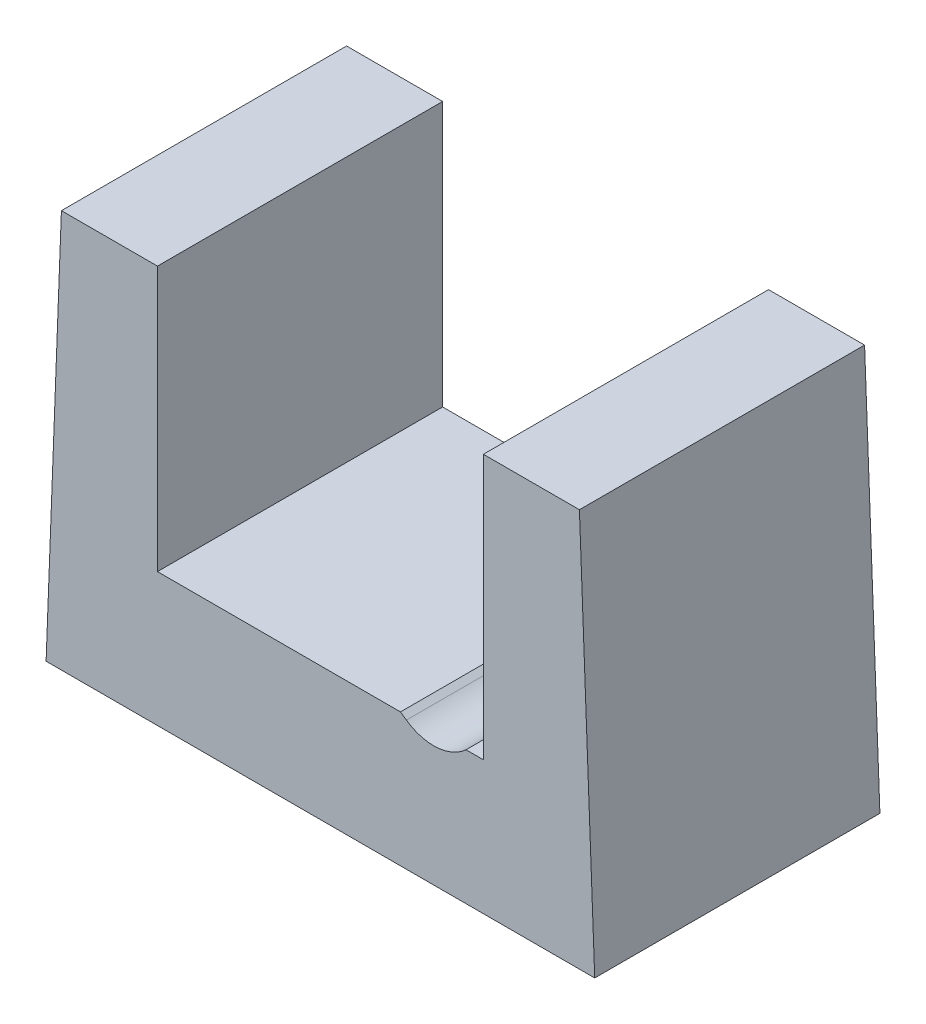
from build123d import *

# Parameters (mm, degrees)
SKETCH1_R               = 1.5
SKETCH1_R_2             = 3.95
MAIN_BODY_LINK_B1_DEPTH = 21
CUT_EXTRUDE1_REACH      = 170.233
PULLEYIDLER_DEPTH       = 21
FILLET1_R               = 1
SKETCH4_W               = 40.4
SKETCH4_H               = 7.4
SKETCH4_W_2             = 38.1446978
SKETCH4_H_2             = 45.516821784
CUT_EXTRUDE2_DEPTH      = 169.23348591
CUT_EXTRUDE4_DEPTH      = 124.656147707


with BuildPart() as part:
    # Sketch1 → Main Body Link B1 (new body)
    with BuildSketch(Plane.XY):
        with BuildLine():
            Line((0, 83.474052381), (9.1, 83.474052381))
            Line((9.1, 83.474052381), (9.1, 89.474052381))
            Line((9.1, 89.474052381), (11.1, 89.474052381))
            Line((11.1, 89.474052381), (11.1, 83.474052381))
            Line((11.1, 83.474052381), (20.2, 83.474052381))
            Line((20.2, 83.474052381), (20.2, 90.874052381))
            Line((20.2, 90.874052381), (17.986683974, 148.383116621))
            ThreePointArc((17.986683974, 148.383116621), (0, 165.690874165), (-17.986683974, 148.383116621))
            Line((-17.986683974, 148.383116621), (-20.2, 90.874052381))
            Line((-20.2, 90.874052381), (-20.2, 83.474052381))
            Line((-20.2, 83.474052381), (-11.1, 83.474052381))
            Line((-11.1, 83.474052381), (-11.1, 89.474052381))
            Line((-11.1, 89.474052381), (-9.1, 89.474052381))
            Line((-9.1, 89.474052381), (-9.1, 83.474052381))
            Line((-9.1, 83.474052381), (0, 83.474052381))
        make_face()
        with Locations(Location((5.2, 88.124052381, 0), (0, 0, 180))):
            Circle(SKETCH1_R, mode=Mode.SUBTRACT)
        with Locations(Location((15, 88.124052381, 0), (0, 0, 180))):
            Circle(SKETCH1_R, mode=Mode.SUBTRACT)
        with Locations(Location((-15, 88.124052381, 0), (0, 0, 180))):
            Circle(SKETCH1_R, mode=Mode.SUBTRACT)
        with Locations(Location((-5.2, 88.124052381, 0), (0, 0, 180))):
            Circle(SKETCH1_R, mode=Mode.SUBTRACT)
        with Locations(Location((0, 147.690874165, 0), (0, 0, 180))):
            Circle(SKETCH1_R_2, mode=Mode.SUBTRACT)
    extrude(amount=MAIN_BODY_LINK_B1_DEPTH)

    # Sketch2 → Cut-Extrude1 (cut, up to next)
    with BuildSketch(Plane.XY.offset(21), mode=Mode.PRIVATE) as cut_extrude1_sk1:
        Polygon((-3.278172542, 117.482670232), (12, 128.172168466), (12, 106.793171999), align=None)
    cut_extrude1_tool1 = extrude(cut_extrude1_sk1.sketch, amount=-CUT_EXTRUDE1_REACH, mode=Mode.PRIVATE) & part.part
    # Sketch2 → Cut-Extrude1 (cut, up to next)
    with BuildSketch(Plane.XY.offset(21), mode=Mode.PRIVATE) as cut_extrude1_sk2:
        with BuildLine():
            ThreePointArc((-12, 134.2744663), (-7.774454217, 131.456408925), (-2.929911079, 129.930929878))
            Line((-2.929911079, 129.930929878), (-12, 123.584968066))
            Line((-12, 123.584968066), (-12, 134.2744663))
        make_face()
    cut_extrude1_tool2 = extrude(cut_extrude1_sk2.sketch, amount=-CUT_EXTRUDE1_REACH, mode=Mode.PRIVATE) & part.part
    # Sketch2 → Cut-Extrude1 (cut, up to next)
    with BuildSketch(Plane.XY.offset(21), mode=Mode.PRIVATE) as cut_extrude1_sk3:
        Polygon((-12, 111.380372399), (-12, 100.690874165), (3.278172542, 100.690874165), align=None)
    cut_extrude1_tool3 = extrude(cut_extrude1_sk3.sketch, amount=-CUT_EXTRUDE1_REACH, mode=Mode.PRIVATE) & part.part
    add(cut_extrude1_tool1.solids().sort_by_distance((6.907276, 117.48267, 21))[0], mode=Mode.SUBTRACT)
    add(cut_extrude1_tool2.solids().sort_by_distance((-9.12997, 128.978342, 21))[0], mode=Mode.SUBTRACT)
    add(cut_extrude1_tool3.solids().sort_by_distance((-6.907276, 104.25404, 21))[0], mode=Mode.SUBTRACT)

    # Sketch3 → PulleyIdler (cut)
    with BuildSketch(Plane.XY.offset(21)):
        with BuildLine():
            Line((-5.959092644, 108.984491566), (6.331359583, 100.385376259))
            ThreePointArc((6.331359583, 100.385376259), (11.205592008, 101.246688207), (10.34428006, 106.120920631))
            Line((10.34428006, 106.120920631), (-1.946172167, 114.720035938))
            ThreePointArc((-1.946172167, 114.720035938), (-6.820404592, 113.85872399), (-5.959092644, 108.984491566))
        make_face()
    extrude(amount=-PULLEYIDLER_DEPTH, mode=Mode.SUBTRACT)

    # Fillet1
    fillet1_edges = [part.edges().sort_by_distance(p)[0] for p in [
        (-3.278172542, 117.482670232, 10.5),
        (12, 128.172168466, 10.5),
        (12, 106.793171999, 10.5),
        (-12, 134.2744663, 10.5),
        (-2.929911079, 129.930929878, 10.5),
        (-12, 123.584968066, 10.5),
        (-12, 111.380372399, 10.5),
        (3.278172542, 100.690874165, 10.5),
        (-12, 100.690874165, 10.5),
    ]]
    fillet(fillet1_edges, radius=FILLET1_R)

    # Sketch4 → Cut-Extrude2 (cut, through all)
    with BuildSketch(Plane.XY.offset(21)):
        with Locations((0, 87.174052381)):
            Rectangle(SKETCH4_W, SKETCH4_H)
        with Locations((0, 142.932463273)):
            Rectangle(SKETCH4_W_2, SKETCH4_H_2)
    extrude(amount=-CUT_EXTRUDE2_DEPTH, mode=Mode.SUBTRACT)

    # Sketch5 → Cut-Extrude4 (cut, through all)
    with BuildSketch(Plane.XY.offset(21)):
        with BuildLine():
            Line((-12, 100.690874165), (5.894720779, 100.690874165))
            Line((5.894720779, 100.690874165), (6.331359583, 100.385376259))
            ThreePointArc((6.331359583, 100.385376259), (8.580755157, 99.761589707), (10.722091306, 100.690874165))
            Line((10.722091306, 100.690874165), (12, 100.690874165))
            Line((12, 100.690874165), (12, 120.174052381))
            Line((12, 120.174052381), (-12, 120.174052381))
            Line((-12, 120.174052381), (-12, 100.690874165))
        make_face()
    extrude(amount=-CUT_EXTRUDE4_DEPTH, mode=Mode.SUBTRACT)


solid = part.part
